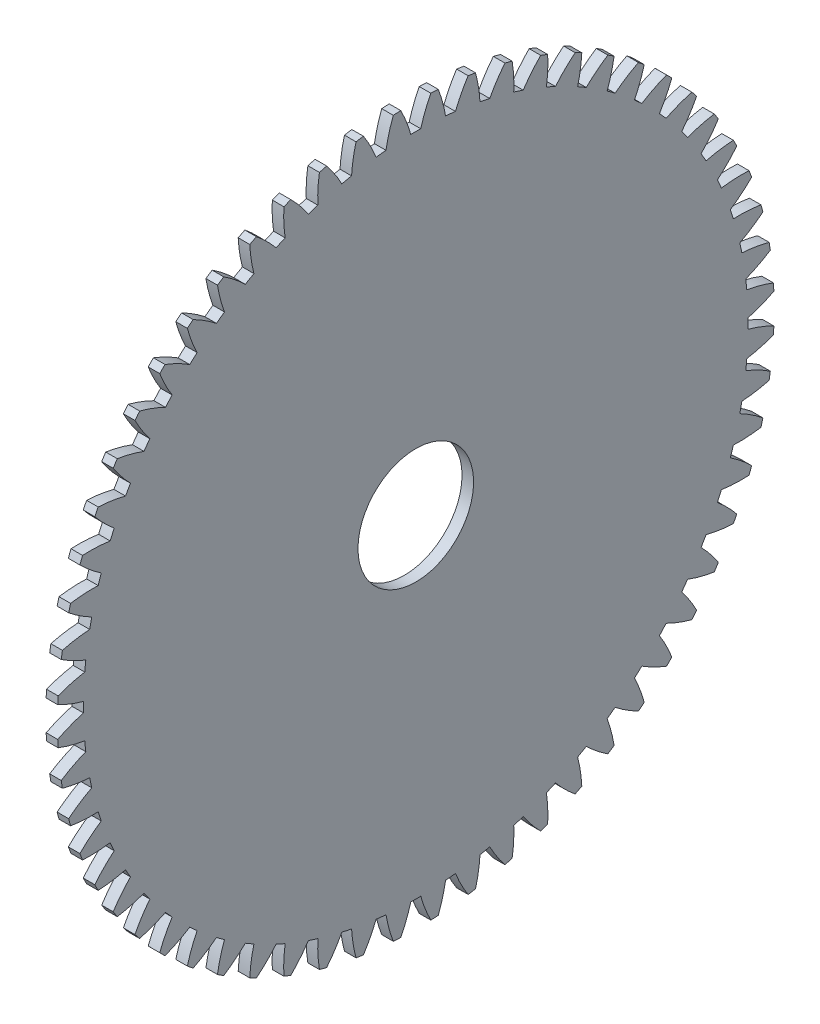
from build123d import *

# Parameters (mm, degrees)
BASPROSKE_W     = 1
BASPROSKE_H     = 31
TOOTHCUT_DEPTH  = 44.852023899
TEETHCUTS_COUNT = 60
TEETHCUTS_ANGLE = 354
BORSKE_R        = 5
BORE_DEPTH      = 50.0000508


with BuildPart() as part:
    # BasProSke → Base-Revolve (revolve)
    with BuildSketch(Plane(origin=(0, 0, 0), x_dir=(1, 0, 0), z_dir=(0, 1, 0)), mode=Mode.PRIVATE) as base_revolve_sk:
        with Locations((0.5, 15.5)):
            Rectangle(BASPROSKE_W, BASPROSKE_H)
    revolve(base_revolve_sk.sketch.rotate(Axis((-10, 0, 0), (1, 0, 0)), 180), axis=Axis((-10, 0, 0), (1, 0, 0)))

    # TooCutSke → ToothCut (cut, through all)
    with BuildSketch(Plane(origin=(0, 0, 0), x_dir=(0, 0, -1), z_dir=(1, 0, 0))):
        with BuildLine():
            ThreePointArc((0.430151971, 28.745781782), (0, 28.749), (-0.430151971, 28.745781782))
            ThreePointArc((-0.430151971, 28.745781782), (-0.81454129, 29.893990802), (-1.312684569, 30.997617721))
            ThreePointArc((-1.312684569, 30.997617721), (0, 31.0254), (1.312684569, 30.997617721))
            ThreePointArc((1.312684569, 30.997617721), (0.81454129, 29.893990802), (0.430151971, 28.745781782))
        make_face()
    toothcut = extrude(amount=TOOTHCUT_DEPTH, mode=Mode.SUBTRACT)

    # TeethCuts: ToothCut ×60 about axis
    teethcuts_axis = Axis((-10, 0, 0), (1, 0, 0))
    for i in range(1, TEETHCUTS_COUNT):
        add(toothcut.rotate(teethcuts_axis, i * TEETHCUTS_ANGLE / (TEETHCUTS_COUNT - 1)), mode=Mode.SUBTRACT)

    # BorSke → Bore (cut, symmetric)
    with BuildSketch(Plane(origin=(0, 0, 0), x_dir=(0, 0, -1), z_dir=(1, 0, 0))):
        with Locations(Location((0, 0, 0), (0, 0, 180))):
            Circle(BORSKE_R)
    extrude(amount=BORE_DEPTH, both=True, mode=Mode.SUBTRACT)


solid = part.part
